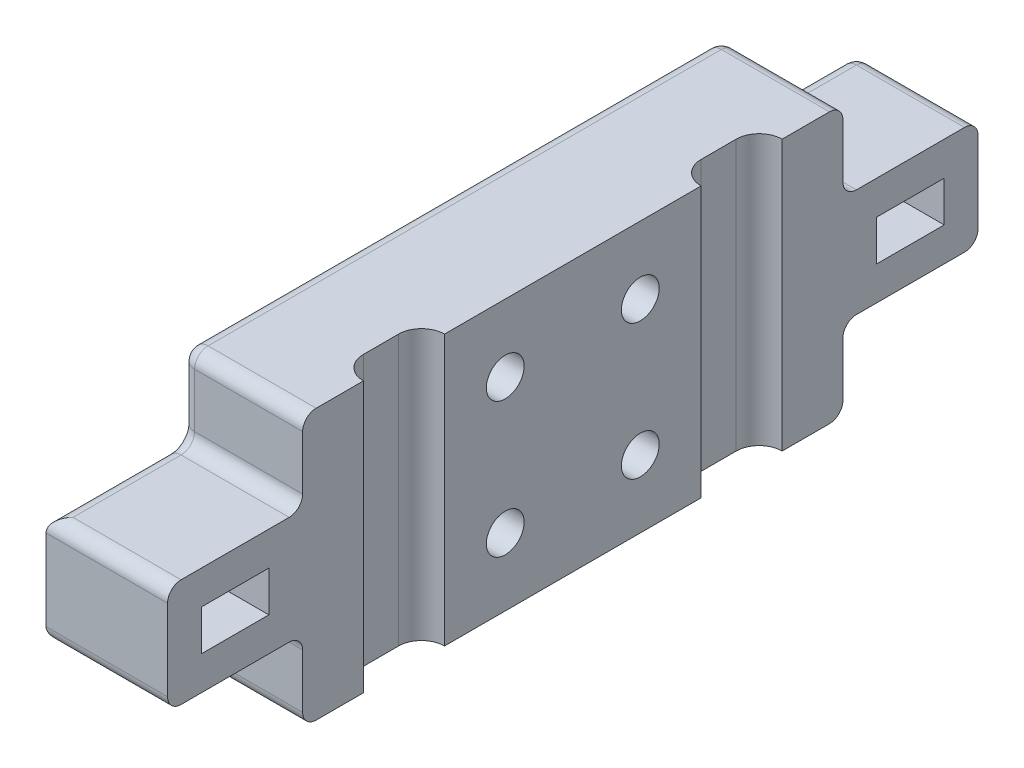
from build123d import *

# Parameters (mm, degrees)
BASE_DEPTH           = 20
SKETCH2_R            = 1.4
SCREW_HOLES_DEPTH    = 30.681644159
SKETCH3_W            = 10
SKETCH3_H            = 8
SKETCH3_W_2          = 5
SKETCH3_H_2          = 3
ZIP_TIE_SLOTS_DEPTH  = 9
F_1MM_EDGE_FILLETS_R = 1


with BuildPart() as part:
    # Sketch1 → Base (new body)
    with BuildSketch(Plane(origin=(0, 0, 0), x_dir=(1, 0, 0), z_dir=(0, 1, 0))):
        with BuildLine():
            Line((9, 20), (9, 15.5))
            ThreePointArc((9, 15.5), (7.797918472, 15.002081528), (7.3, 13.8))
            Line((7.3, 13.8), (7.3, 11.2))
            ThreePointArc((7.3, 11.2), (7.797918472, 9.997918472), (9, 9.5))
            Line((9, 9.5), (9, -9.5))
            ThreePointArc((9, -9.5), (7.797918472, -9.997918472), (7.3, -11.2))
            Line((7.3, -11.2), (7.3, -13.8))
            ThreePointArc((7.3, -13.8), (7.797918472, -15.002081528), (9, -15.5))
            Line((9, -15.5), (9, -20))
            Line((9, -20), (0, -20))
            Line((0, -20), (0, 20))
            Line((0, 20), (9, 20))
        make_face()
    extrude(amount=BASE_DEPTH)

    # Sketch2 → Screw Holes (cut, through all)
    with BuildSketch(Plane(origin=(9, 0, 0), x_dir=(0, 0, -1), z_dir=(1, 0, 0))):
        with Locations((-5, 15)):
            Circle(SKETCH2_R)
        with Locations((5, 15)):
            Circle(SKETCH2_R)
        with Locations((5, 5)):
            Circle(SKETCH2_R)
        with Locations((-5, 5)):
            Circle(SKETCH2_R)
    extrude(amount=-SCREW_HOLES_DEPTH, mode=Mode.SUBTRACT)

    # Sketch3 → Zip Tie Slots (add)
    # profile 1 of 2: a face of its own
    with BuildSketch(Plane(origin=(0, 0, 0), x_dir=(0, 0, -1), z_dir=(1, 0, 0))):
        with Locations((-25, 10)):
            Rectangle(SKETCH3_W, SKETCH3_H)
        with Locations((-25, 10)):
            Rectangle(SKETCH3_W_2, SKETCH3_H_2, mode=Mode.SUBTRACT)
    # profile 2 of 2: a face of its own
    with BuildSketch(Plane(origin=(0, 0, 0), x_dir=(0, 0, -1), z_dir=(1, 0, 0))):
        with Locations((25, 10)):
            Rectangle(SKETCH3_W, SKETCH3_H)
        with Locations((25, 10)):
            Rectangle(SKETCH3_W_2, SKETCH3_H_2, mode=Mode.SUBTRACT)
    extrude(amount=ZIP_TIE_SLOTS_DEPTH)

    # 1mm Edge Fillets
    f_1mm_edge_fillets_edges = [part.edges().sort_by_distance(p)[0] for p in [
        (4.5, 0, -20),
        (4.5, 0, 20),
        (0, 0, 0),
        (0, 17, -20),
        (0, 17, 20),
        (4.5, 20, -20),
        (0, 20, 0),
        (0, 3, 20),
        (4.5, 6, 20),
        (4.5, 14, 20),
        (0, 14, 25),
        (4.5, 14, 30),
        (4.5, 6, 30),
        (0, 6, 25),
        (0, 3, -20),
        (4.5, 14, -20),
        (4.5, 6, -20),
        (0, 6, -25),
        (4.5, 6, -30),
        (0, 10, -30),
        (4.5, 14, -30),
        (0, 14, -25),
        (4.5, 20, 20),
    ]]
    fillet(f_1mm_edge_fillets_edges, radius=F_1MM_EDGE_FILLETS_R)


solid = part.part
